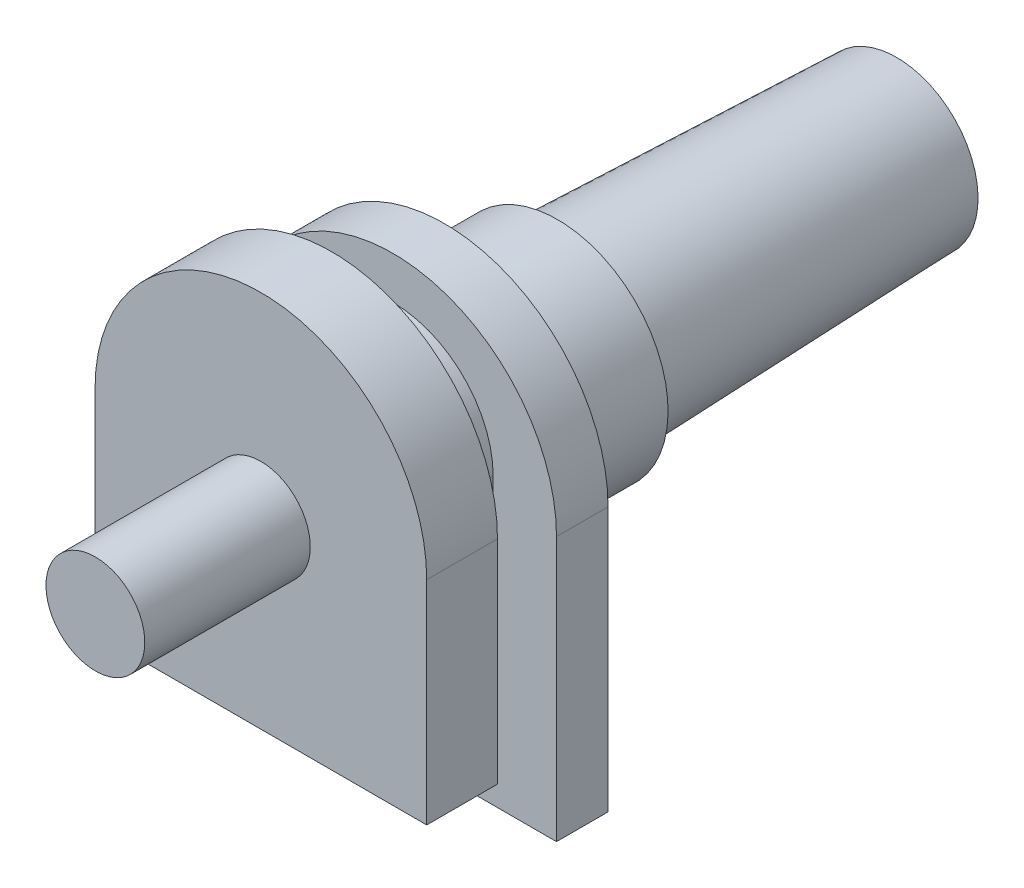
from build123d import *

# Parameters (mm, degrees)
BOSS_EXTRUDE1_DEPTH = 3.13
BOSS_EXTRUDE2_DEPTH = 2.71
BOSS_EXTRUDE3_DEPTH = 2.28
SKETCH6_W           = 7.320164266
SKETCH6_H           = 2.185


with BuildPart() as part:
    # Sketch1 → Boss-Extrude1 (new body)
    with BuildSketch(Plane.XY):
        with BuildLine():
            Line((-7.335, 0), (-7.335, -9.395))
            Line((-7.335, -9.395), (7.335, -9.395))
            Line((7.335, -9.395), (7.335, 0))
            ThreePointArc((7.335, 0), (0, 7.335), (-7.335, 0))
        make_face()
    extrude(amount=BOSS_EXTRUDE1_DEPTH)

    # Sketch2 → Boss-Extrude2 (add)
    with BuildSketch(Plane(origin=(0, 0, 0), x_dir=(-1, 0, 0), z_dir=(0, 0, -1))):
        with BuildLine():
            Line((-4.435, -0.4), (-4.435, -6.755))
            Line((-4.435, -6.755), (4.435, -6.755))
            Line((4.435, -6.755), (4.435, -0.4))
            ThreePointArc((4.435, -0.4), (0, 4.035), (-4.435, -0.4))
        make_face()
    extrude(amount=BOSS_EXTRUDE2_DEPTH)

    # Sketch3 → Boss-Extrude3 (add)
    with BuildSketch(Plane(origin=(0, 0, -2.71), x_dir=(-1, 0, 0), z_dir=(0, 0, -1))):
        with BuildLine():
            Line((-7.235, -13.005), (7.235, -13.005))
            Line((7.235, -13.005), (7.235, -1.32))
            ThreePointArc((7.235, -1.32), (0, 5.915), (-7.235, -1.32))
            Line((-7.235, -1.32), (-7.235, -13.005))
        make_face()
    extrude(amount=BOSS_EXTRUDE3_DEPTH)

    # Sketch5 → Revolve1 (revolve)
    with BuildSketch(Plane(origin=(0, 0, 0), x_dir=(0, 0, -1), z_dir=(1, 0, 0)), mode=Mode.PRIVATE) as revolve1_sk:
        Polygon((4.99, 3.57), (9.99, 3.57), (9.99, 2.815), (24.99, 2.28), (24.99, -1.32), (4.99, -1.32), align=None)
    revolve(revolve1_sk.sketch.rotate(Axis((0, -1.32, -24.99), (0, 0, -1)), 180), axis=Axis((0, -1.32, -24.99), (0, 0, -1)))

    # Sketch6 → Revolve2 (revolve)
    with BuildSketch(Plane(origin=(0, 0, 0), x_dir=(0, 0, -1), z_dir=(1, 0, 0))):
        with Locations((-6.790082133, -0.2275)):
            Rectangle(SKETCH6_W, SKETCH6_H)
    revolve(axis=Axis((0, -1.32, 10.450164266), (0, 0, 1)))


solid = part.part
